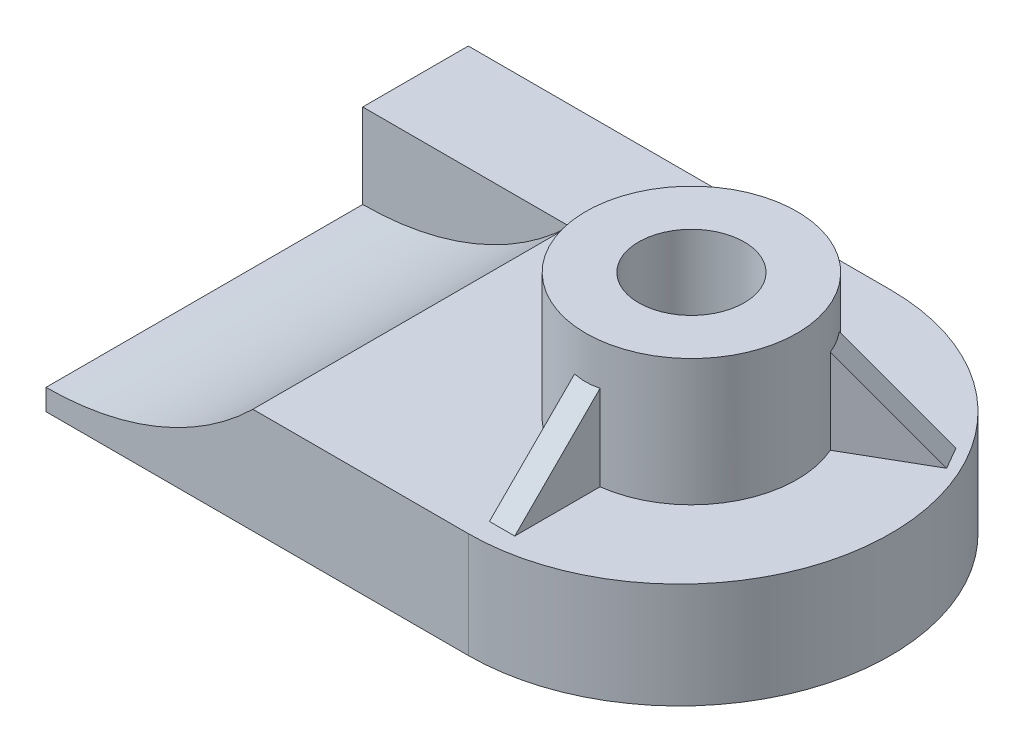
from build123d import *

# Parameters (mm, degrees)
BOSS_EXTRUDE1_DEPTH = 25
CUT_EXTRUDE1_DEPTH  = 75
SKETCH3_R           = 25
SKETCH3_R_2         = 12.5
BOSS_EXTRUDE2_DEPTH = 30
RIB2_REACH          = 129.02
SKETCH5_WALL_W      = 284.323638276
SKETCH5_WALL_H      = 6
CIRPATTERN1_COUNT   = 3


with BuildPart() as part:
    # Sketch1 → Boss-Extrude1 (new body)
    with BuildSketch(Plane(origin=(0, 0, 0), x_dir=(1, 0, 0), z_dir=(0, 1, 0))):
        with BuildLine():
            Line((-50, 50), (50, 50))
            ThreePointArc((50, 50), (100, 0), (50, -50))
            Line((50, -50), (-50, -50))
            Line((-50, -50), (-50, 50))
        make_face()
    extrude(amount=BOSS_EXTRUDE1_DEPTH)

    # Sketch2 → Cut-Extrude1 (cut)
    with BuildSketch(Plane.XY.offset(50)):
        with BuildLine():
            Line((-1.010205144, 25), (-50, 25))
            Line((-50, 25), (-50, 5))
            ThreePointArc((-50, 5), (-23.542486889, 10.192593016), (-1.010205144, 25))
        make_face()
    extrude(amount=-CUT_EXTRUDE1_DEPTH, mode=Mode.SUBTRACT)

    # Sketch3 → Boss-Extrude2 (add)
    with BuildSketch(Plane(origin=(0, 25, 0), x_dir=(1, 0, 0), z_dir=(0, 1, 0))):
        with Locations(Location((52.838951486, 0, 0), (0, 0, 90))):
            Circle(SKETCH3_R)
        with Locations(Location((52.838951486, 0, 0), (0, 0, 270))):
            Circle(SKETCH3_R_2, mode=Mode.SUBTRACT)
    extrude(amount=BOSS_EXTRUDE2_DEPTH)

    # Sketch5 wall → Rib2 (add, up to next)
    with BuildSketch(Plane(origin=(53, 35, 35), x_dir=(0, -0.707106781187, 0.707106781187), z_dir=(0, -0.707106781187, -0.707106781187)), mode=Mode.PRIVATE) as rib2_sk1:
        Rectangle(SKETCH5_WALL_W, SKETCH5_WALL_H)
    rib2_tool1 = extrude(rib2_sk1.sketch, amount=RIB2_REACH, mode=Mode.PRIVATE) - part.part
    rib2 = rib2_tool1.solids().sort_by_distance((53, 35, 35))[0]
    add(rib2)

    # CirPattern1: Rib2 ×3 about axis
    cirpattern1_axis = Axis((52.838951486, 0, 0), (0, 1, 0))
    for i in range(1, CIRPATTERN1_COUNT):
        add(rib2.rotate(cirpattern1_axis, i * 360 / CIRPATTERN1_COUNT))


solid = part.part
